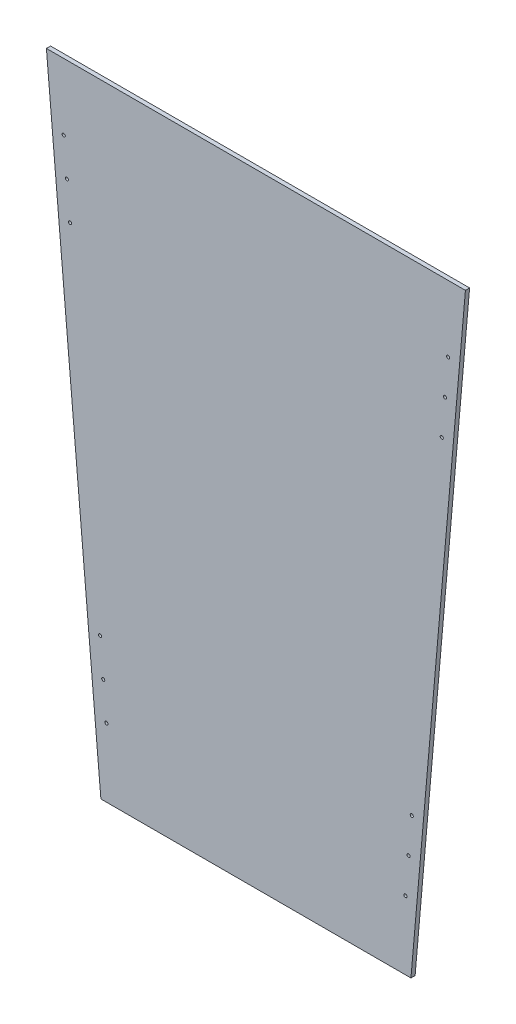
from build123d import *

# Parameters (mm, degrees)
SKETCH2_R           = 1.5
BOSS_EXTRUDE1_DEPTH = 4


with BuildPart() as part:
    # Sketch2 → Boss-Extrude1 (new body)
    with BuildSketch(Plane.XY):
        Polygon((-201.085, 510.519303279), (-148.79, -87.200696721), (148.79, -87.200696721), (201.085, 510.519303279), align=None)
        with Locations((-143.497000101, -21.490696721)):
            Circle(SKETCH2_R, mode=Mode.SUBTRACT)
        with Locations((-146.547451097, 13.376117712)):
            Circle(SKETCH2_R, mode=Mode.SUBTRACT)
        with Locations((-149.597902093, 48.242932145)):
            Circle(SKETCH2_R, mode=Mode.SUBTRACT)
        with Locations((-178.360333434, 376.989303279)):
            Circle(SKETCH2_R, mode=Mode.SUBTRACT)
        with Locations((-181.410784431, 411.856117712)):
            Circle(SKETCH2_R, mode=Mode.SUBTRACT)
        with Locations((-184.461235427, 446.722932145)):
            Circle(SKETCH2_R, mode=Mode.SUBTRACT)
        with Locations(Location((143.497000101, -21.490696721, 0), (0, 0, 180))):
            Circle(SKETCH2_R, mode=Mode.SUBTRACT)
        with Locations(Location((146.547451097, 13.376117712, 0), (0, 0, 180))):
            Circle(SKETCH2_R, mode=Mode.SUBTRACT)
        with Locations(Location((149.597902093, 48.242932145, 0), (0, 0, 180))):
            Circle(SKETCH2_R, mode=Mode.SUBTRACT)
        with Locations(Location((178.360333434, 376.989303279, 0), (0, 0, 180))):
            Circle(SKETCH2_R, mode=Mode.SUBTRACT)
        with Locations(Location((181.410784431, 411.856117712, 0), (0, 0, 180))):
            Circle(SKETCH2_R, mode=Mode.SUBTRACT)
        with Locations(Location((184.461235427, 446.722932145, 0), (0, 0, 180))):
            Circle(SKETCH2_R, mode=Mode.SUBTRACT)
    extrude(amount=BOSS_EXTRUDE1_DEPTH)


solid = part.part
